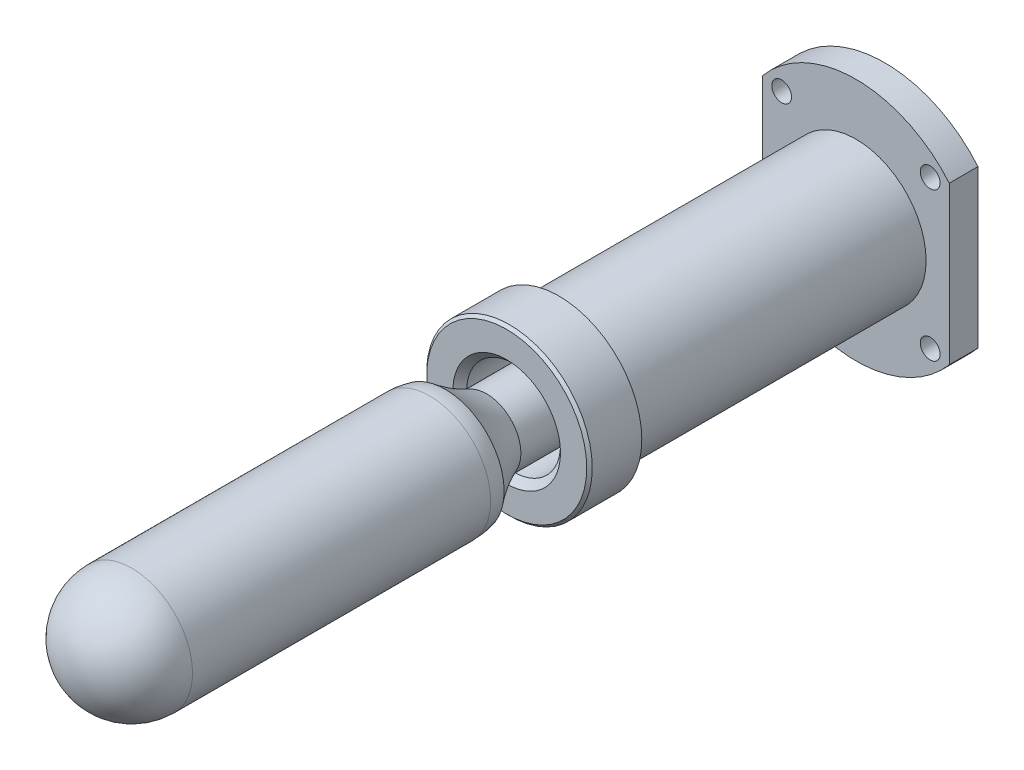
from build123d import *

# Parameters (mm, degrees)
SKETCH1_R           = 5.15
SKETCH1_R_2         = 1.79
BOSS_EXTRUDE1_DEPTH = 5.2
SKETCH1_12_R        = 12.7
SKETCH1_12_R_2      = 8.7
BOSS_EXTRUDE2_DEPTH = 59
SKETCH4_R           = 15
SKETCH4_R_2         = 8.5
BOSS_EXTRUDE3_DEPTH = 9.47
CHAMFER1_SIZE       = 0.5
SKETCH1_14_R        = 1.5
CUT_EXTRUDE1_DEPTH  = 40
CHAMFER2_SIZE       = 1.25


with BuildPart() as part:
    # Sketch1 → Boss-Extrude1 (new body)
    with BuildSketch(Plane(origin=(0, 0, 0), x_dir=(-1, 0, 0), z_dir=(0, 0, 1))):
        with BuildLine():
            Line((7, 14.240786495), (7, -14.240786495))
            ThreePointArc((7, -14.240786495), (23.9, -22.1), (40.8, -14.240786495))
            Line((40.8, -14.240786495), (40.8, 14.240786495))
            ThreePointArc((40.8, 14.240786495), (23.9, 22.1), (7, 14.240786495))
        make_face()
        with Locations((23.9, 0)):
            Circle(SKETCH1_R, mode=Mode.SUBTRACT)
        with Locations((37.370384182, 13.470384182)):
            Circle(SKETCH1_R_2, mode=Mode.SUBTRACT)
        with Locations((10.464971157, 13.435028843)):
            Circle(SKETCH1_R_2, mode=Mode.SUBTRACT)
        with Locations((37.370384182, -13.470384182)):
            Circle(SKETCH1_R_2, mode=Mode.SUBTRACT)
        with Locations((10.464971157, -13.435028843)):
            Circle(SKETCH1_R_2, mode=Mode.SUBTRACT)
    extrude(amount=BOSS_EXTRUDE1_DEPTH)

    # Sketch1<12> → Boss-Extrude2 (add)
    # profile 1 of 2: a face of its own
    with BuildSketch(Plane(origin=(0, 0, 0), x_dir=(-1, 0, 0), z_dir=(0, 0, 1))):
        with Locations((-23.9, 0)):
            Circle(SKETCH1_12_R)
    # profile 2 of 2: a face of its own
    with BuildSketch(Plane(origin=(0, 0, 0), x_dir=(-1, 0, 0), z_dir=(0, 0, 1))):
        with Locations((23.9, 0)):
            Circle(SKETCH1_12_R)
        with Locations((23.9, 0)):
            Circle(SKETCH1_12_R_2, mode=Mode.SUBTRACT)
    extrude(amount=BOSS_EXTRUDE2_DEPTH)


with BuildPart() as boss_extrude2_piece_1:
    # of the separate pieces the step leaves, piece 1, a body of its own (boss_extrude2_pieces)
    add(part.part.solids().sort_by_distance((11.2, 0, 0))[0])


with BuildPart() as boss_extrude2_piece_2:
    # of the separate pieces the step leaves, piece 2, a body of its own (boss_extrude2_pieces)
    add(part.part.solids().sort_by_distance((-7, 14.240786495, 0))[0])

    # Sketch4 → Boss-Extrude3 (add)
    with BuildSketch(Plane.XY.offset(59)):
        with Locations((-23.9, 0)):
            Circle(SKETCH4_R)
        with Locations((-23.9, 0)):
            Circle(SKETCH4_R_2, mode=Mode.SUBTRACT)
    extrude(amount=BOSS_EXTRUDE3_DEPTH)

    # Chamfer1
    chamfer1_edges = [boss_extrude2_piece_2.edges().sort_by_distance(p)[0] for p in [
        (-38.9, 0, 68.47),
    ]]
    chamfer(chamfer1_edges, length=CHAMFER1_SIZE)

    # Sketch1<14> → Cut-Extrude1 (cut)
    with BuildSketch(Plane(origin=(0, 0, 0), x_dir=(-1, 0, 0), z_dir=(0, 0, 1))):
        with Locations((28.071249413, 10.070286904)):
            Circle(SKETCH1_14_R)
        with Locations((19.728750587, 10.070286904)):
            Circle(SKETCH1_14_R)
        with Locations((13.829713096, 4.171249413)):
            Circle(SKETCH1_14_R)
        with Locations((13.829713096, -4.171249413)):
            Circle(SKETCH1_14_R)
        with Locations((19.728750587, -10.070286904)):
            Circle(SKETCH1_14_R)
        with Locations((28.071249413, -10.070286904)):
            Circle(SKETCH1_14_R)
        with Locations((33.970286904, -4.171249413)):
            Circle(SKETCH1_14_R)
        with Locations((33.970286904, 4.171249413)):
            Circle(SKETCH1_14_R)
    extrude(amount=CUT_EXTRUDE1_DEPTH, mode=Mode.SUBTRACT)

    # Chamfer2
    chamfer2_edges = [boss_extrude2_piece_2.edges().sort_by_distance(p)[0] for p in [
        (-32.4, 0, 68.47),
    ]]
    chamfer(chamfer2_edges, length=CHAMFER2_SIZE)


with BuildPart() as body_3:
    # Sketch3 → Revolve1 (revolve)
    with BuildSketch(Plane(origin=(0, 0, 0), x_dir=(1, 0, 0), z_dir=(0, 1, 0))):
        with BuildLine():
            Line((-28.122479737, -59.076243563), (-23.9, -59.076243563))
            Line((-23.9, -59.076243563), (-23.9, -147.37754342))
            ThreePointArc((-23.9, -147.37754342), (-31.678174593, -144.155718013), (-34.9, -136.37754342))
            Line((-34.9, -136.37754342), (-34.9, -82.37754342))
            ThreePointArc((-34.9, -82.37754342), (-34.80895489, -80.965203799), (-34.53732669, -79.576243563))
            add(Edge.make_bspline(
                [(-34.53732669, -79.576243563), (-31.795977893, -76.148228367), (-30.122479737, -72.122431473)],
                knots=[0, 0, 0, 1, 1, 1], degree=2))
            Line((-30.122479737, -72.122431473), (-30.122479737, -61.076243563))
            ThreePointArc((-30.122479737, -61.076243563), (-29.536693299, -59.662030001), (-28.122479737, -59.076243563))
        make_face()
    revolve(axis=Axis((-23.9, 0, 59.076243563), (0, 0, 1)))


solid = Compound([boss_extrude2_piece_2.part, body_3.part])
